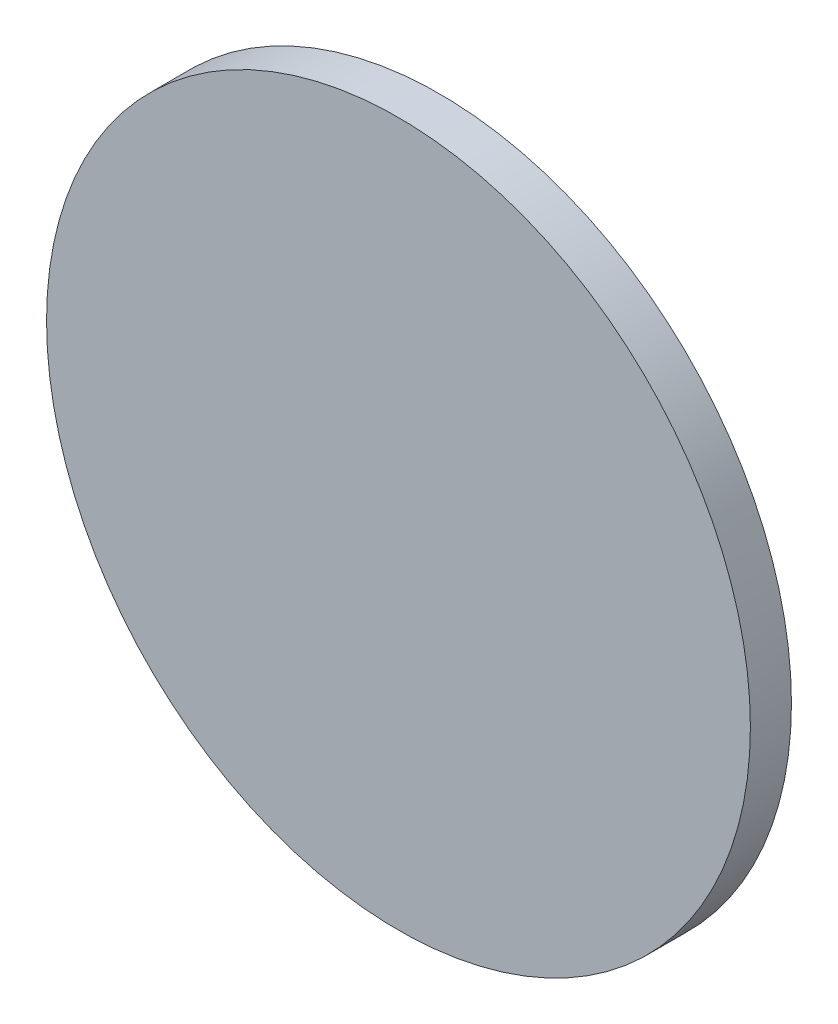
from build123d import *

# Parameters (mm, degrees)
ESQUISSE1_R        = 6
BOSS_EXTRU_1_DEPTH = 0.7


with BuildPart() as part:
    # Esquisse1 → Boss.-Extru.1 (new body)
    with BuildSketch(Plane.XY):
        Circle(ESQUISSE1_R)
    extrude(amount=BOSS_EXTRU_1_DEPTH)


solid = part.part
